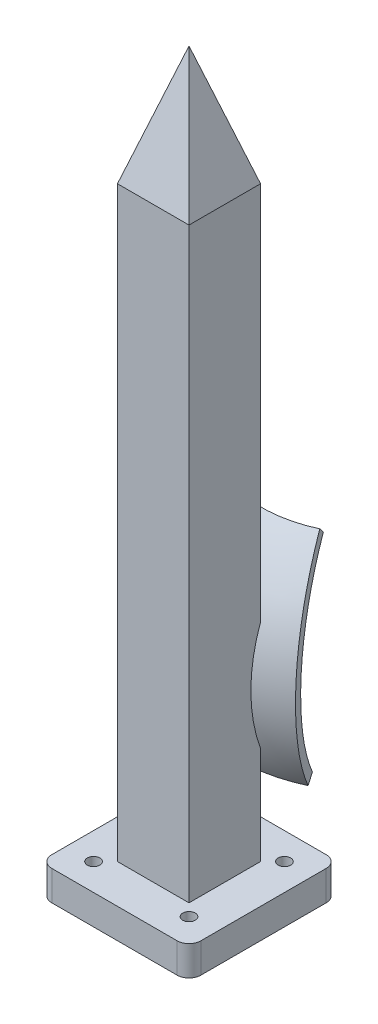
from build123d import *

# Parameters (mm, degrees)
SKETCH1_W                = 25
SKETCH1_H                = 25
BOSS_EXTRUDE1_DEPTH      = 5
SKETCH2_R                = 1.05
CUT_EXTRUDE1_DEPTH       = 5
FILLET1_R                = 2
SKETCH3_W                = 12
SKETCH3_H                = 12
SKETCH3_W_2              = 6
SKETCH3_H_2              = 6
BOSS_EXTRUDE2_DEPTH      = 98.425
SKETCH4_W                = 6
SKETCH4_H                = 6
CUT_EXTRUDE2_DEPTH       = 10
SKETCH5_W                = 12
SKETCH5_H                = 12
BOSS_EXTRUDE3_DEPTH      = 20
CUT_EXTRUDE3_DEPTH       = 20
CUT_EXTRUDE4_DEPTH       = 20
REVOLVE1_ANGLE           = 25
REVOLVE1_OTHER_WAY_ANGLE = 25


with BuildPart() as part:
    # Sketch1 → Boss-Extrude1 (new body)
    with BuildSketch(Plane(origin=(0, 0, 0), x_dir=(1, 0, 0), z_dir=(0, 1, 0))):
        with Locations((12.5, 12.5)):
            Rectangle(SKETCH1_W, SKETCH1_H)
    extrude(amount=BOSS_EXTRUDE1_DEPTH)

    # Sketch2 → Cut-Extrude1 (cut)
    with BuildSketch(Plane(origin=(0, 5, 0), x_dir=(1, 0, 0), z_dir=(0, 1, 0))):
        with Locations(Location((4.5, 4.5, 0), (0, 0, 270))):
            Circle(SKETCH2_R)
        with Locations(Location((20.5, 4.5, 0), (0, 0, 270))):
            Circle(SKETCH2_R)
        with Locations(Location((20.5, 20.5, 0), (0, 0, 270))):
            Circle(SKETCH2_R)
        with Locations(Location((4.5, 20.5, 0), (0, 0, 270))):
            Circle(SKETCH2_R)
    extrude(amount=-CUT_EXTRUDE1_DEPTH, mode=Mode.SUBTRACT)

    # Fillet1
    fillet1_edges = [part.edges().sort_by_distance(p)[0] for p in [
        (0, 2.5, -25),
        (25, 2.5, -25),
        (25, 2.5, 0),
        (0, 2.5, 0),
    ]]
    fillet(fillet1_edges, radius=FILLET1_R)

    # Sketch3 → Boss-Extrude2 (add)
    with BuildSketch(Plane(origin=(0, 5, 0), x_dir=(1, 0, 0), z_dir=(0, 1, 0))):
        with Locations((12.5, 12.5)):
            Rectangle(SKETCH3_W, SKETCH3_H)
        with Locations((12.5, 12.5)):
            Rectangle(SKETCH3_W_2, SKETCH3_H_2, mode=Mode.SUBTRACT)
    extrude(amount=BOSS_EXTRUDE2_DEPTH)

    # Sketch4 → Cut-Extrude2 (cut)
    with BuildSketch(Plane(origin=(0, 0, 0), x_dir=(-1, 0, 0), z_dir=(0, -1, 0))):
        with Locations((-12.5, 12.5)):
            Rectangle(SKETCH4_W, SKETCH4_H)
    extrude(amount=-CUT_EXTRUDE2_DEPTH, mode=Mode.SUBTRACT)

    # Sketch5 → Boss-Extrude3 (add)
    with BuildSketch(Plane(origin=(0, 103.425, 0), x_dir=(1, 0, 0), z_dir=(0, 1, 0))):
        with Locations((12.5, 12.5)):
            Rectangle(SKETCH5_W, SKETCH5_H)
    extrude(amount=BOSS_EXTRUDE3_DEPTH)

    # Sketch6 → Cut-Extrude3 (cut)
    with BuildSketch(Plane.XY.offset(-6.5)):
        Polygon((18.5, 123.425), (12.5, 123.425), (18.5, 103.425), align=None)
        Polygon((6.5, 103.425), (12.5, 123.425), (6.5, 123.425), align=None)
    extrude(amount=-CUT_EXTRUDE3_DEPTH, mode=Mode.SUBTRACT)

    # Sketch7 → Cut-Extrude4 (cut)
    with BuildSketch(Plane.ZY.offset(-6.5)):
        Polygon((-6.5, 123.425), (-6.5, 103.425), (-12.5, 123.425), align=None)
        Polygon((-18.5, 123.425), (-18.5, 103.425), (-12.5, 123.425), align=None)
    extrude(amount=-CUT_EXTRUDE4_DEPTH, mode=Mode.SUBTRACT)

    # Sketch8 → Revolve1 (revolve)
    with BuildSketch(Plane(origin=(12.5, 0, 0), x_dir=(0, 0, -1), z_dir=(1, 0, 0))):
        with BuildLine():
            ThreePointArc((24.627603923, 50.372343644), (16.394708904, 33.808356072), (20.558863125, 15.785979305))
            Line((20.558863125, 15.785979305), (22.064703847, 16.753815466))
            ThreePointArc((22.064703847, 16.753815466), (18.172495187, 33.599217247), (25.867730183, 49.081471856))
            Line((25.867730183, 49.081471856), (24.627603923, 50.372343644))
        make_face()
    revolve(axis=Axis((12.5, 54.79169199, -43.616981759), (0, -1, 0)), revolution_arc=REVOLVE1_ANGLE)

    # Sketch8 → Revolve1 other way (revolve)
    with BuildSketch(Plane(origin=(12.5, 0, 0), x_dir=(0, 0, -1), z_dir=(1, 0, 0))):
        with BuildLine():
            ThreePointArc((24.627603923, 50.372343644), (16.394708904, 33.808356072), (20.558863125, 15.785979305))
            Line((20.558863125, 15.785979305), (22.064703847, 16.753815466))
            ThreePointArc((22.064703847, 16.753815466), (18.172495187, 33.599217247), (25.867730183, 49.081471856))
            Line((25.867730183, 49.081471856), (24.627603923, 50.372343644))
        make_face()
    revolve(axis=Axis((12.5, 54.79169199, -43.616981759), (0, 1, 0)), revolution_arc=REVOLVE1_OTHER_WAY_ANGLE)


solid = part.part
